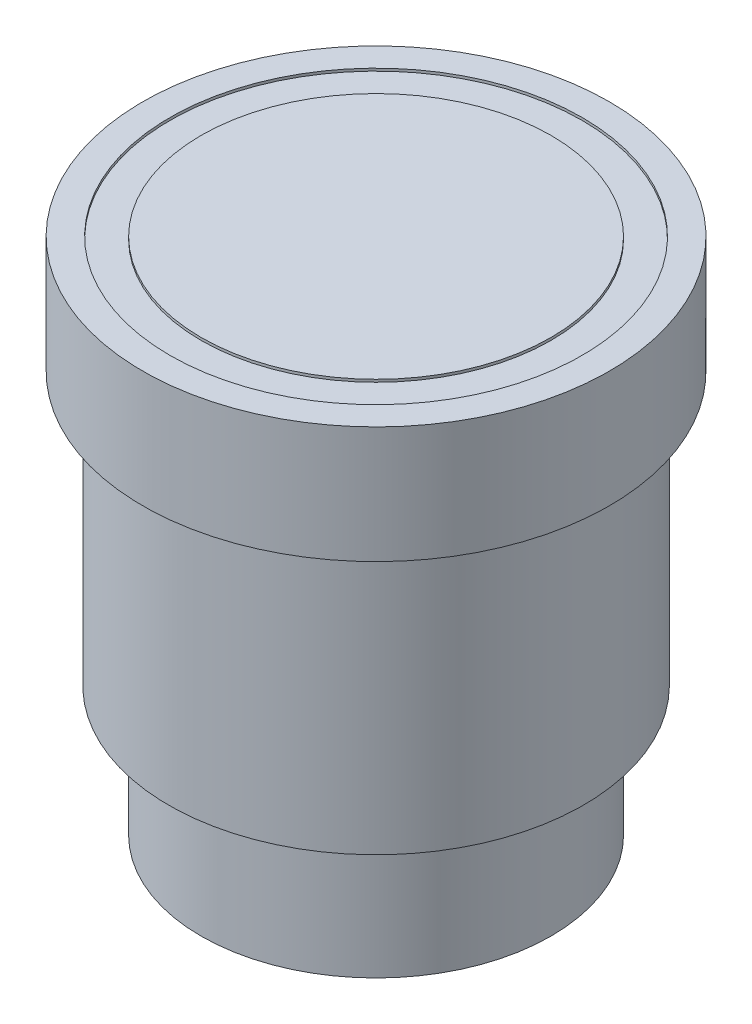
from build123d import *

# Parameters (mm, degrees)
CUT_EXTRUDE1_START = -0.1
SKETCH2_R          = 7.95
SKETCH2_R_2        = 6.75
CUT_EXTRUDE1_DEPTH = 0.1


with BuildPart() as part:
    # Sketch1 → Revolve1 (revolve)
    with BuildSketch(Plane(origin=(0, 0, 0), x_dir=(0, 0, -1), z_dir=(1, 0, 0))):
        Polygon((0, 20), (9, 20), (9, 15.5), (8, 15.5), (8, 5), (6.75, 5), (6.75, 0), (0, 0), align=None)
    revolve(axis=Axis((0, 0, 0), (0, 1, 0)))

    # Sketch2 → Cut-Extrude1 (cut)
    with BuildSketch(Plane(origin=(0, 20, 0), x_dir=(1, 0, 0), z_dir=(0, 1, 0)).offset(CUT_EXTRUDE1_START)):
        with Locations(Location((0, 0, 0), (0, 0, 270))):
            Circle(SKETCH2_R)
        with Locations(Location((0, 0, 0), (0, 0, 90))):
            Circle(SKETCH2_R_2, mode=Mode.SUBTRACT)
    extrude(amount=CUT_EXTRUDE1_DEPTH, mode=Mode.SUBTRACT)


solid = part.part
